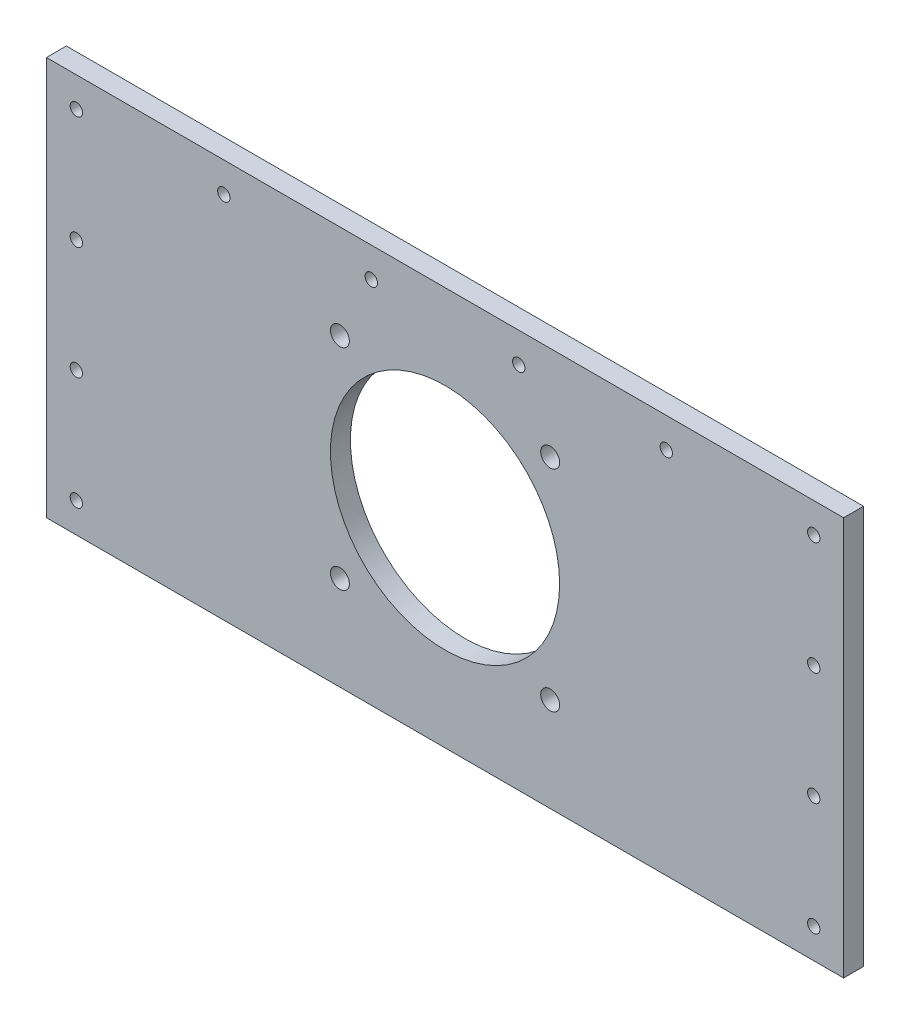
from build123d import *

# Parameters (mm, degrees)
SKETCH1_W           = 400
SKETCH1_H           = 200
SKETCH1_R           = 4.75
SKETCH1_R_2         = 57.5
BOSS_EXTRUDE1_DEPTH = 10
SKETCH2_R           = 3.1
CUT_EXTRUDE1_DEPTH  = 10


with BuildPart() as part:
    # Sketch1 → Boss-Extrude1 (new body)
    with BuildSketch(Plane.XY):
        Rectangle(SKETCH1_W, SKETCH1_H)
        with Locations((-52.757236944, 52.757236944)):
            Circle(SKETCH1_R, mode=Mode.SUBTRACT)
        with Locations((52.757236944, 52.757236944)):
            Circle(SKETCH1_R, mode=Mode.SUBTRACT)
        with Locations((52.757236944, -52.757236944)):
            Circle(SKETCH1_R, mode=Mode.SUBTRACT)
        with Locations((-52.757236944, -52.757236944)):
            Circle(SKETCH1_R, mode=Mode.SUBTRACT)
        Circle(SKETCH1_R_2, mode=Mode.SUBTRACT)
    extrude(amount=BOSS_EXTRUDE1_DEPTH)

    # Sketch2 → Cut-Extrude1 (cut)
    with BuildSketch(Plane.XY.offset(10)):
        with Locations((-185, 85)):
            Circle(SKETCH2_R)
        with Locations((-185, 28.333333333)):
            Circle(SKETCH2_R)
        with Locations((-185, -85)):
            Circle(SKETCH2_R)
        with Locations((-185, -28.333333333)):
            Circle(SKETCH2_R)
        with Locations(Location((185, -28.333333333, 0), (0, 0, 180))):
            Circle(SKETCH2_R)
        with Locations(Location((185, -85, 0), (0, 0, 180))):
            Circle(SKETCH2_R)
        with Locations(Location((185, 28.333333333, 0), (0, 0, 180))):
            Circle(SKETCH2_R)
        with Locations(Location((185, 85, 0), (0, 0, 180))):
            Circle(SKETCH2_R)
        with Locations((-111, 85)):
            Circle(SKETCH2_R)
        with Locations((-37, 85)):
            Circle(SKETCH2_R)
        with Locations((37, 85)):
            Circle(SKETCH2_R)
        with Locations((111, 85)):
            Circle(SKETCH2_R)
    extrude(amount=-CUT_EXTRUDE1_DEPTH, mode=Mode.SUBTRACT)


solid = part.part
